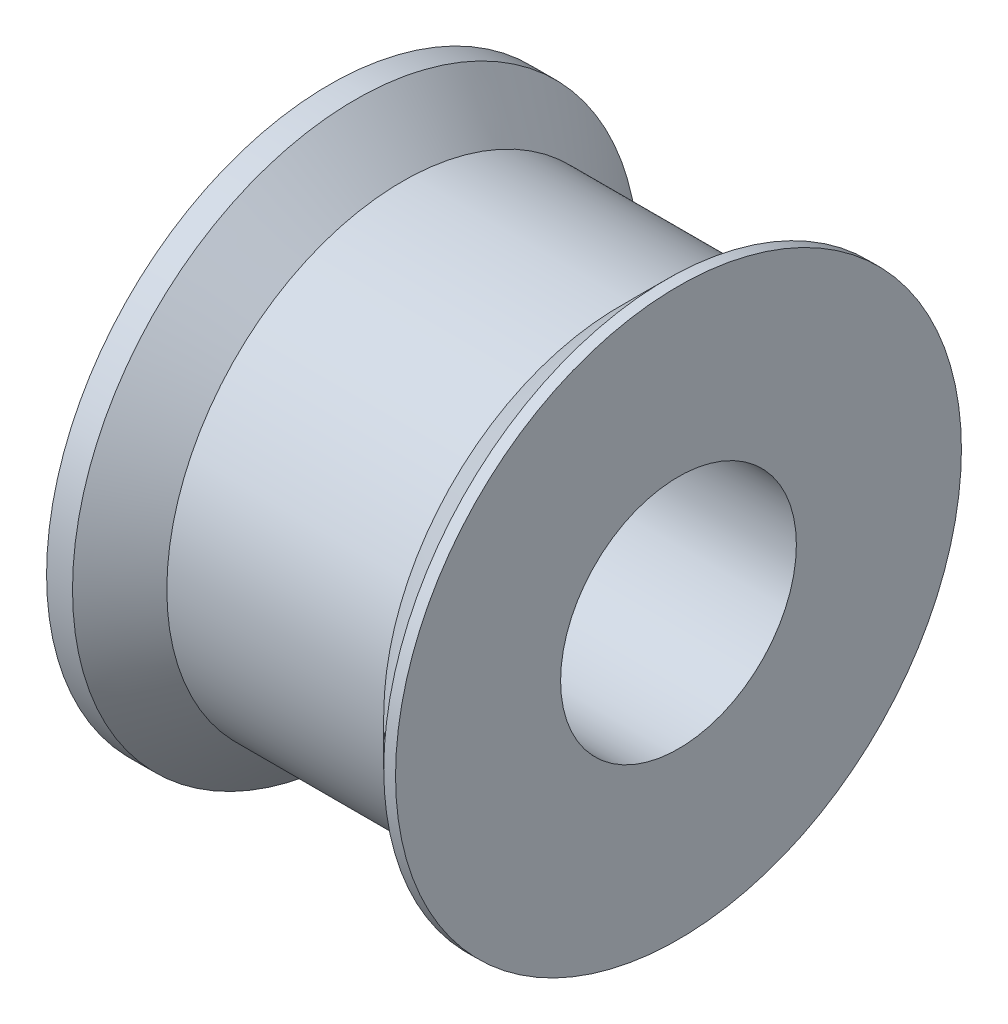
from build123d import *

# Parameters (mm, degrees)
SKETCH3_R          = 3.1
CUT_EXTRUDE1_DEPTH = 14.8
CUT_EXTRUDE2_START = -2
SKETCH4_R          = 5
CUT_EXTRUDE2_DEPTH = 12.8


with BuildPart() as part:
    # Sketch2 → Revolve1 (revolve)
    with BuildSketch(Plane(origin=(0, 0, 0), x_dir=(1, 0, 0), z_dir=(0, 1, 0))):
        Polygon((-7.7, 12), (-7.7, 0), (-7.1, 0), (7.1, 0), (7.1, 12), (6.6, 12), (4.6, 10), (-4.6, 10), (-6.6, 12), (-7.1, 12), align=None)
    revolve(axis=Axis((7.1, 0, 0), (-1, 0, 0)))

    # Sketch3 → Cut-Extrude1 (cut)
    with BuildSketch(Plane.ZY.offset(7.7)):
        Circle(SKETCH3_R)
    extrude(amount=-CUT_EXTRUDE1_DEPTH, mode=Mode.SUBTRACT)

    # Sketch4 → Cut-Extrude2 (cut)
    with BuildSketch(Plane.ZY.offset(7.7).offset(CUT_EXTRUDE2_START)):
        Circle(SKETCH4_R)
    extrude(amount=-CUT_EXTRUDE2_DEPTH, mode=Mode.SUBTRACT)


solid = part.part
